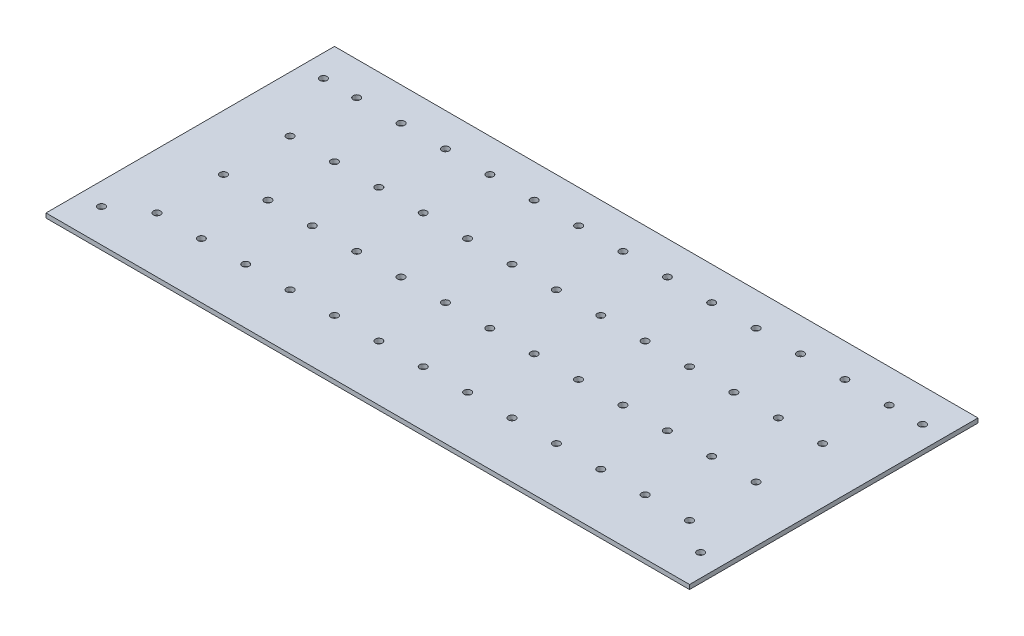
from build123d import *

# Parameters (mm, degrees)
SKETCH1_W           = 290
SKETCH1_H           = 130
SKETCH1_R           = 1.6
BOSS_EXTRUDE1_DEPTH = 2


with BuildPart() as part:
    # Sketch1 → Boss-Extrude1 (new body)
    with BuildSketch(Plane(origin=(0, 0, 0), x_dir=(1, 0, 0), z_dir=(0, 1, 0))):
        Rectangle(SKETCH1_W, SKETCH1_H)
        with Locations(Location((-135, 50, 0), (0, 0, 270))):
            Circle(SKETCH1_R, mode=Mode.SUBTRACT)
        with Locations(Location((-135, -50, 0), (0, 0, 270))):
            Circle(SKETCH1_R, mode=Mode.SUBTRACT)
        with Locations(Location((135, -50, 0), (0, 0, 270))):
            Circle(SKETCH1_R, mode=Mode.SUBTRACT)
        with Locations(Location((135, 50, 0), (0, 0, 270))):
            Circle(SKETCH1_R, mode=Mode.SUBTRACT)
        with Locations(Location((-120, 50, 0), (0, 0, 270))):
            Circle(SKETCH1_R, mode=Mode.SUBTRACT)
        with Locations(Location((-100, 50, 0), (0, 0, 270))):
            Circle(SKETCH1_R, mode=Mode.SUBTRACT)
        with Locations(Location((-80, 50, 0), (0, 0, 270))):
            Circle(SKETCH1_R, mode=Mode.SUBTRACT)
        with Locations(Location((-60, 50, 0), (0, 0, 270))):
            Circle(SKETCH1_R, mode=Mode.SUBTRACT)
        with Locations(Location((-40, 50, 0), (0, 0, 270))):
            Circle(SKETCH1_R, mode=Mode.SUBTRACT)
        with Locations(Location((-20, 50, 0), (0, 0, 270))):
            Circle(SKETCH1_R, mode=Mode.SUBTRACT)
        with Locations(Location((0, 50, 0), (0, 0, 270))):
            Circle(SKETCH1_R, mode=Mode.SUBTRACT)
        with Locations(Location((20, 50, 0), (0, 0, 270))):
            Circle(SKETCH1_R, mode=Mode.SUBTRACT)
        with Locations(Location((40, 50, 0), (0, 0, 270))):
            Circle(SKETCH1_R, mode=Mode.SUBTRACT)
        with Locations(Location((60, 50, 0), (0, 0, 270))):
            Circle(SKETCH1_R, mode=Mode.SUBTRACT)
        with Locations(Location((80, 50, 0), (0, 0, 270))):
            Circle(SKETCH1_R, mode=Mode.SUBTRACT)
        with Locations(Location((100, 50, 0), (0, 0, 270))):
            Circle(SKETCH1_R, mode=Mode.SUBTRACT)
        with Locations(Location((120, 50, 0), (0, 0, 270))):
            Circle(SKETCH1_R, mode=Mode.SUBTRACT)
        with Locations(Location((-100, 20, 0), (0, 0, 270))):
            Circle(SKETCH1_R, mode=Mode.SUBTRACT)
        with Locations(Location((-80, 20, 0), (0, 0, 270))):
            Circle(SKETCH1_R, mode=Mode.SUBTRACT)
        with Locations(Location((-60, 20, 0), (0, 0, 270))):
            Circle(SKETCH1_R, mode=Mode.SUBTRACT)
        with Locations(Location((-40, 20, 0), (0, 0, 270))):
            Circle(SKETCH1_R, mode=Mode.SUBTRACT)
        with Locations(Location((-20, 20, 0), (0, 0, 270))):
            Circle(SKETCH1_R, mode=Mode.SUBTRACT)
        with Locations(Location((0, 20, 0), (0, 0, 270))):
            Circle(SKETCH1_R, mode=Mode.SUBTRACT)
        with Locations(Location((20, 20, 0), (0, 0, 270))):
            Circle(SKETCH1_R, mode=Mode.SUBTRACT)
        with Locations(Location((40, 20, 0), (0, 0, 270))):
            Circle(SKETCH1_R, mode=Mode.SUBTRACT)
        with Locations(Location((60, 20, 0), (0, 0, 270))):
            Circle(SKETCH1_R, mode=Mode.SUBTRACT)
        with Locations(Location((80, 20, 0), (0, 0, 270))):
            Circle(SKETCH1_R, mode=Mode.SUBTRACT)
        with Locations(Location((100, 20, 0), (0, 0, 270))):
            Circle(SKETCH1_R, mode=Mode.SUBTRACT)
        with Locations(Location((120, 20, 0), (0, 0, 270))):
            Circle(SKETCH1_R, mode=Mode.SUBTRACT)
        with Locations(Location((-100, -10, 0), (0, 0, 270))):
            Circle(SKETCH1_R, mode=Mode.SUBTRACT)
        with Locations(Location((-80, -10, 0), (0, 0, 270))):
            Circle(SKETCH1_R, mode=Mode.SUBTRACT)
        with Locations(Location((-60, -10, 0), (0, 0, 270))):
            Circle(SKETCH1_R, mode=Mode.SUBTRACT)
        with Locations(Location((-40, -10, 0), (0, 0, 270))):
            Circle(SKETCH1_R, mode=Mode.SUBTRACT)
        with Locations(Location((-20, -10, 0), (0, 0, 270))):
            Circle(SKETCH1_R, mode=Mode.SUBTRACT)
        with Locations(Location((0, -10, 0), (0, 0, 270))):
            Circle(SKETCH1_R, mode=Mode.SUBTRACT)
        with Locations(Location((20, -10, 0), (0, 0, 270))):
            Circle(SKETCH1_R, mode=Mode.SUBTRACT)
        with Locations(Location((40, -10, 0), (0, 0, 270))):
            Circle(SKETCH1_R, mode=Mode.SUBTRACT)
        with Locations(Location((60, -10, 0), (0, 0, 270))):
            Circle(SKETCH1_R, mode=Mode.SUBTRACT)
        with Locations(Location((80, -10, 0), (0, 0, 270))):
            Circle(SKETCH1_R, mode=Mode.SUBTRACT)
        with Locations(Location((100, -10, 0), (0, 0, 270))):
            Circle(SKETCH1_R, mode=Mode.SUBTRACT)
        with Locations(Location((120, -10, 0), (0, 0, 270))):
            Circle(SKETCH1_R, mode=Mode.SUBTRACT)
        with Locations(Location((-100, -40, 0), (0, 0, 270))):
            Circle(SKETCH1_R, mode=Mode.SUBTRACT)
        with Locations(Location((-80, -40, 0), (0, 0, 270))):
            Circle(SKETCH1_R, mode=Mode.SUBTRACT)
        with Locations(Location((-60, -40, 0), (0, 0, 270))):
            Circle(SKETCH1_R, mode=Mode.SUBTRACT)
        with Locations(Location((-40, -40, 0), (0, 0, 270))):
            Circle(SKETCH1_R, mode=Mode.SUBTRACT)
        with Locations(Location((-20, -40, 0), (0, 0, 270))):
            Circle(SKETCH1_R, mode=Mode.SUBTRACT)
        with Locations(Location((0, -40, 0), (0, 0, 270))):
            Circle(SKETCH1_R, mode=Mode.SUBTRACT)
        with Locations(Location((20, -40, 0), (0, 0, 270))):
            Circle(SKETCH1_R, mode=Mode.SUBTRACT)
        with Locations(Location((40, -40, 0), (0, 0, 270))):
            Circle(SKETCH1_R, mode=Mode.SUBTRACT)
        with Locations(Location((60, -40, 0), (0, 0, 270))):
            Circle(SKETCH1_R, mode=Mode.SUBTRACT)
        with Locations(Location((80, -40, 0), (0, 0, 270))):
            Circle(SKETCH1_R, mode=Mode.SUBTRACT)
        with Locations(Location((100, -40, 0), (0, 0, 270))):
            Circle(SKETCH1_R, mode=Mode.SUBTRACT)
        with Locations(Location((120, -40, 0), (0, 0, 270))):
            Circle(SKETCH1_R, mode=Mode.SUBTRACT)
        with Locations(Location((-120, 20, 0), (0, 0, 270))):
            Circle(SKETCH1_R, mode=Mode.SUBTRACT)
        with Locations(Location((-120, -10, 0), (0, 0, 270))):
            Circle(SKETCH1_R, mode=Mode.SUBTRACT)
        with Locations(Location((-120, -40, 0), (0, 0, 270))):
            Circle(SKETCH1_R, mode=Mode.SUBTRACT)
    extrude(amount=BOSS_EXTRUDE1_DEPTH)


solid = part.part
